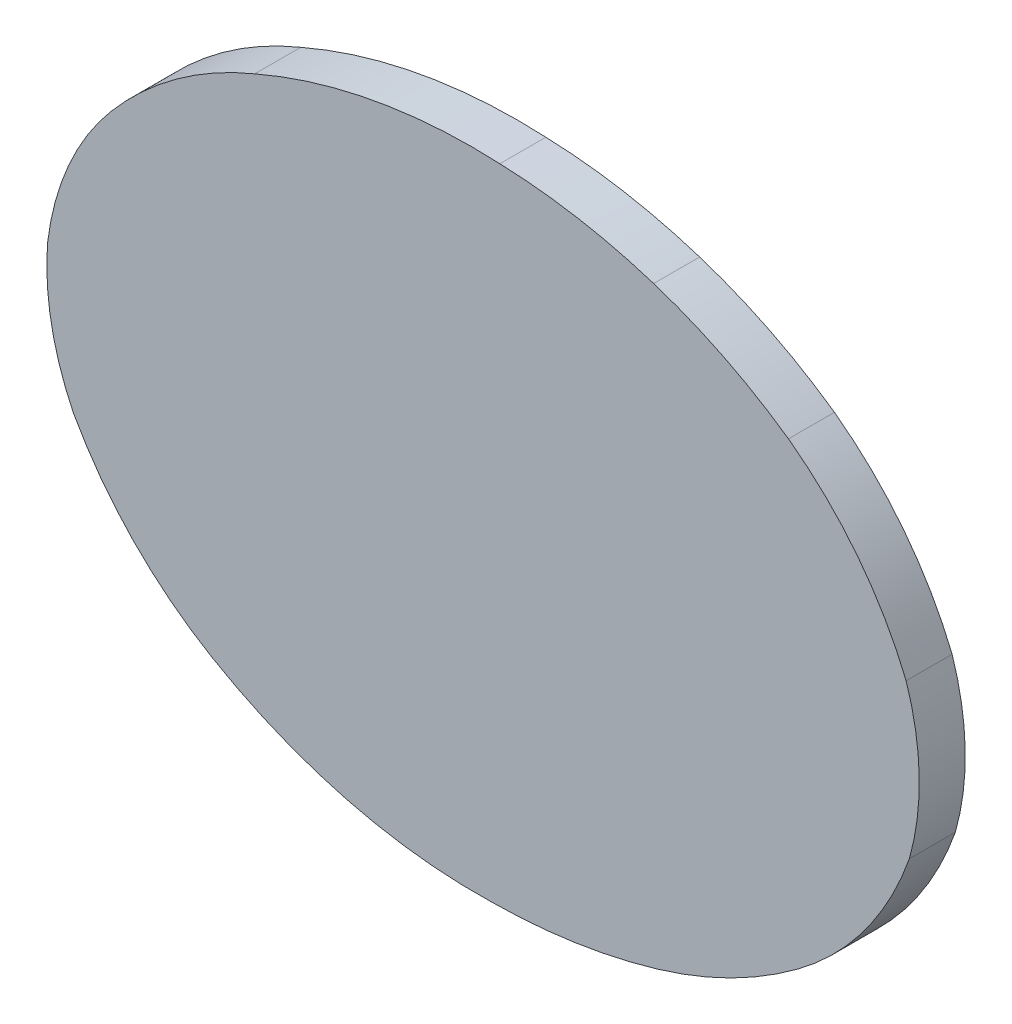
from build123d import *

# Parameters (mm, degrees)
BOSS_EXTRUDE1_DEPTH = 1
BOSS_EXTRUDE2_START = -2
BOSS_EXTRUDE2_DEPTH = 2
BOSS_EXTRUDE3_START = 2
BOSS_EXTRUDE3_DEPTH = 2


with BuildPart() as part:
    # Sketch2 → Boss-Extrude1 (new body)
    with BuildSketch(Plane.XY):
        with BuildLine():
            ThreePointArc((14.582306461, -23.937478676), (20.662688223, -21.536481735), (26.227582561, -18.10606198))
            ThreePointArc((26.227582561, -18.10606198), (31.602803157, -12.702637223), (35.175830441, -5.970366314))
            ThreePointArc((35.175830441, -5.970366314), (35.940455788, 0.032211939), (34.924872534, 5.997460321))
            ThreePointArc((34.924872534, 5.997460321), (30.999615253, 12.739070672), (25.401678251, 18.172306925))
            ThreePointArc((25.401678251, 18.172306925), (20.023450582, 21.36826462), (14.22923276, 23.727611624))
            ThreePointArc((14.22923276, 23.727611624), (7.882073391, 25.295796991), (1.378547715, 25.966461733))
            ThreePointArc((1.378547715, 25.966461733), (-9.069964823, 25.28846457), (-19.084442092, 22.232104078))
            ThreePointArc((-19.084442092, 22.232104078), (-25.480773521, 18.669901445), (-30.847619904, 13.690011561))
            ThreePointArc((-30.847619904, 13.690011561), (-34.216625408, 8.281245191), (-35.888880176, 2.132382229))
            ThreePointArc((-35.888880176, 2.132382229), (-35.572811659, -3.288450427), (-33.85309471, -8.438974634))
            ThreePointArc((-33.85309471, -8.438974634), (-28.98576201, -14.979441817), (-22.570123581, -20.01016961))
            ThreePointArc((-22.570123581, -20.01016961), (-11.367274893, -24.644691823), (0.679303276, -26.009451613))
            ThreePointArc((0.679303276, -26.009451613), (7.703427235, -25.460763497), (14.582306461, -23.937478676))
        make_face()
    extrude(amount=BOSS_EXTRUDE1_DEPTH)

    # Sketch3 → Boss-Extrude2 (add)
    with BuildSketch(Plane.XY.offset(1).offset(BOSS_EXTRUDE2_START)):
        with BuildLine():
            ThreePointArc((-23.584596954, -21.733783191), (-11.876170523, -26.578887071), (0.714158664, -28.009233893))
            ThreePointArc((0.714158664, -28.009233893), (8.007585987, -27.437521821), (15.150208477, -25.855156256))
            ThreePointArc((15.150208477, -25.855156256), (21.558193731, -23.324796552), (27.422917732, -19.709549999))
            ThreePointArc((27.422917732, -19.709549999), (33.232049111, -13.863052711), (37.082922231, -6.576193708))
            ThreePointArc((37.082922231, -6.576193708), (37.93992708, 0.078373421), (36.802232938, 6.690738583))
            ThreePointArc((36.802232938, 6.690738583), (32.590590722, 13.951259274), (26.567668782, 19.797412042))
            ThreePointArc((26.567668782, 19.797412042), (20.924163176, 23.153997512), (14.843057348, 25.631087228))
            ThreePointArc((14.843057348, 25.631087228), (8.234147075, 27.264583601), (1.462460857, 27.964777266))
            ThreePointArc((1.462460857, 27.964777266), (-9.426205562, 27.256483976), (-19.863550161, 24.074256219))
            ThreePointArc((-19.863550161, 24.074256219), (-26.665599434, 20.281211791), (-32.373640199, 14.982784573))
            ThreePointArc((-32.373640199, 14.982784573), (-36.059000484, 9.059793769), (-37.879998788, 2.325726228))
            ThreePointArc((-37.879998788, 2.325726228), (-37.536082018, -3.670000019), (-35.627002731, -9.364069587))
            ThreePointArc((-35.627002731, -9.364069587), (-30.435882217, -16.357044434), (-23.584596954, -21.733783191))
        make_face()
        with BuildLine():
            ThreePointArc((-22.570123581, -20.01016961), (-11.367274893, -24.644691823), (0.679303276, -26.009451613))
            ThreePointArc((0.679303276, -26.009451613), (7.703427235, -25.460763497), (14.582306461, -23.937478676))
            ThreePointArc((14.582306461, -23.937478676), (20.662688223, -21.536481735), (26.227582561, -18.10606198))
            ThreePointArc((26.227582561, -18.10606198), (31.602803157, -12.702637223), (35.175830441, -5.970366314))
            ThreePointArc((35.175830441, -5.970366314), (35.940455788, 0.032211939), (34.924872534, 5.997460321))
            ThreePointArc((34.924872534, 5.997460321), (30.999615253, 12.739070672), (25.401678251, 18.172306925))
            ThreePointArc((25.401678251, 18.172306925), (20.023450582, 21.36826462), (14.22923276, 23.727611624))
            ThreePointArc((14.22923276, 23.727611624), (7.882073391, 25.295796991), (1.378547715, 25.966461733))
            ThreePointArc((1.378547715, 25.966461733), (-9.069964823, 25.28846457), (-19.084442092, 22.232104078))
            ThreePointArc((-19.084442092, 22.232104078), (-25.480773521, 18.669901445), (-30.847619904, 13.690011561))
            ThreePointArc((-30.847619904, 13.690011561), (-34.216625408, 8.281245191), (-35.888880176, 2.132382229))
            ThreePointArc((-35.888880176, 2.132382229), (-35.572811659, -3.288450427), (-33.85309471, -8.438974634))
            ThreePointArc((-33.85309471, -8.438974634), (-28.98576201, -14.979441817), (-22.570123581, -20.01016961))
        make_face(mode=Mode.SUBTRACT)
    extrude(amount=BOSS_EXTRUDE2_DEPTH)

    # Sketch4 → Boss-Extrude3 (add)
    with BuildSketch(Plane(origin=(0, 0, -1), x_dir=(-1, 0, 0), z_dir=(0, 0, -1)).offset(BOSS_EXTRUDE3_START)):
        with BuildLine():
            ThreePointArc((23.584596954, -21.733783191), (30.435882217, -16.357044434), (35.627002731, -9.364069587))
            ThreePointArc((35.627002731, -9.364069587), (37.536082018, -3.670000019), (37.879998788, 2.325726228))
            ThreePointArc((37.879998788, 2.325726228), (36.059000484, 9.059793769), (32.373640199, 14.982784573))
            ThreePointArc((32.373640199, 14.982784573), (26.665599434, 20.281211791), (19.863550161, 24.074256219))
            ThreePointArc((19.863550161, 24.074256219), (9.426205562, 27.256483976), (-1.462460857, 27.964777266))
            ThreePointArc((-1.462460857, 27.964777266), (-8.234147075, 27.264583601), (-14.843057348, 25.631087228))
            ThreePointArc((-14.843057348, 25.631087228), (-20.924163176, 23.153997512), (-26.567668782, 19.797412042))
            ThreePointArc((-26.567668782, 19.797412042), (-32.590590722, 13.951259274), (-36.802232938, 6.690738583))
            ThreePointArc((-36.802232938, 6.690738583), (-37.93992708, 0.078373421), (-37.082922231, -6.576193708))
            ThreePointArc((-37.082922231, -6.576193708), (-33.232049111, -13.863052711), (-27.422917732, -19.709549999))
            ThreePointArc((-27.422917732, -19.709549999), (-21.558193731, -23.324796552), (-15.150208477, -25.855156256))
            ThreePointArc((-15.150208477, -25.855156256), (-8.007585987, -27.437521821), (-0.714158664, -28.009233893))
            ThreePointArc((-0.714158664, -28.009233893), (11.876170523, -26.578887071), (23.584596954, -21.733783191))
        make_face()
        with BuildLine():
            ThreePointArc((21.555650209, -18.286556029), (27.535330411, -13.602126211), (32.078697256, -7.514575328))
            ThreePointArc((32.078697256, -7.514575328), (33.609473864, -2.907248333), (33.897648559, 1.939162133))
            ThreePointArc((33.897648559, 1.939162133), (32.374200723, 7.502749449), (29.321599609, 12.39723855))
            ThreePointArc((29.321599609, 12.39723855), (24.296047221, 17.05851306), (18.305561132, 20.389839116))
            ThreePointArc((18.305561132, 20.389839116), (8.713855119, 23.320421058), (-1.294621046, 23.968139818))
            ThreePointArc((-1.294621046, 23.968139818), (-7.529992858, 23.327009842), (-13.615408172, 21.82413602))
            ThreePointArc((-13.615408172, 21.82413602), (-19.122622483, 19.582585616), (-24.235471698, 16.547337587))
            ThreePointArc((-24.235471698, 16.547337587), (-29.408223084, 11.527376998), (-33.046936389, 5.305068206))
            ThreePointArc((-33.046936389, 5.305068206), (-33.940979932, -0.013771926), (-33.268351754, -5.365121806))
            ThreePointArc((-33.268351754, -5.365121806), (-29.973321616, -11.542469618), (-25.032247389, -16.502573961))
            ThreePointArc((-25.032247389, -16.502573961), (-19.767182716, -19.748166918), (-14.014404446, -22.019801096))
            ThreePointArc((-14.014404446, -22.019801096), (-7.399238865, -23.484007784), (-0.644388471, -24.00966267))
            ThreePointArc((-0.644388471, -24.00966267), (10.858407416, -22.710487179), (21.555650209, -18.286556029))
        make_face(mode=Mode.SUBTRACT)
    extrude(amount=-BOSS_EXTRUDE3_DEPTH)


solid = part.part
